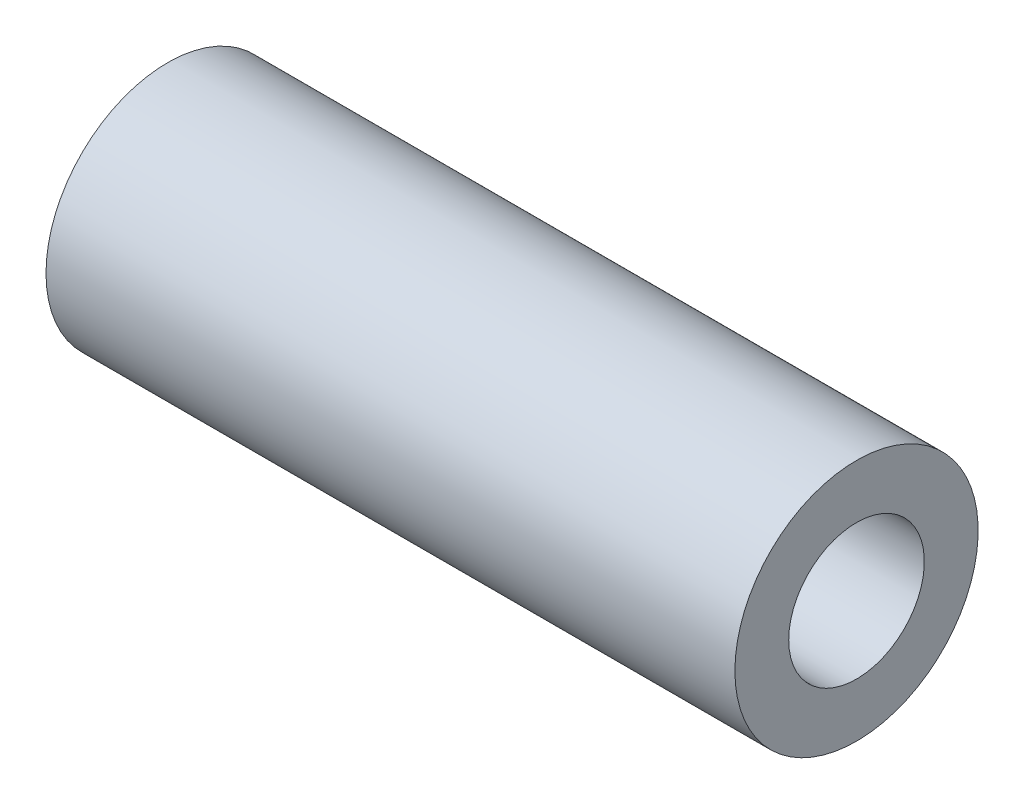
from build123d import *

# Parameters (mm, degrees)
SWEEP1_PROFILE_R     = 8.96875
CUT_SWEEP1_PROFILE_R = 5


with BuildPart() as part:
    # Sweep1: sweep along a path in Sketch1
    with BuildLine(Plane(origin=(0, 0, 0), x_dir=(1, 0, 0), z_dir=(0, 1, 0))) as sweep1_path:
        Line((0, 0), (-50.8, 0))
    # Sweep1 profile (on start of the path) → Sweep1 (sweep)
    with BuildSketch(Plane(origin=(0, 0, 0), x_dir=(0, 0, -1), z_dir=(-1, 0, 0))):
        Circle(SWEEP1_PROFILE_R)
    sweep(path=sweep1_path.line)

    # Cut-Sweep1: sweep along a path in Sketch1<3>
    with BuildLine(Plane(origin=(0, 0, 0), x_dir=(1, 0, 0), z_dir=(0, 1, 0))) as cut_sweep1_path:
        Line((0, 0), (-50.8, 0))
    # Cut-Sweep1 profile (on start of the path) → Cut-Sweep1 (sweep, cut)
    with BuildSketch(Plane(origin=(0, 0, 0), x_dir=(0, 0, -1), z_dir=(-1, 0, 0))):
        Circle(CUT_SWEEP1_PROFILE_R)
    sweep(path=cut_sweep1_path.line, mode=Mode.SUBTRACT)


solid = part.part
